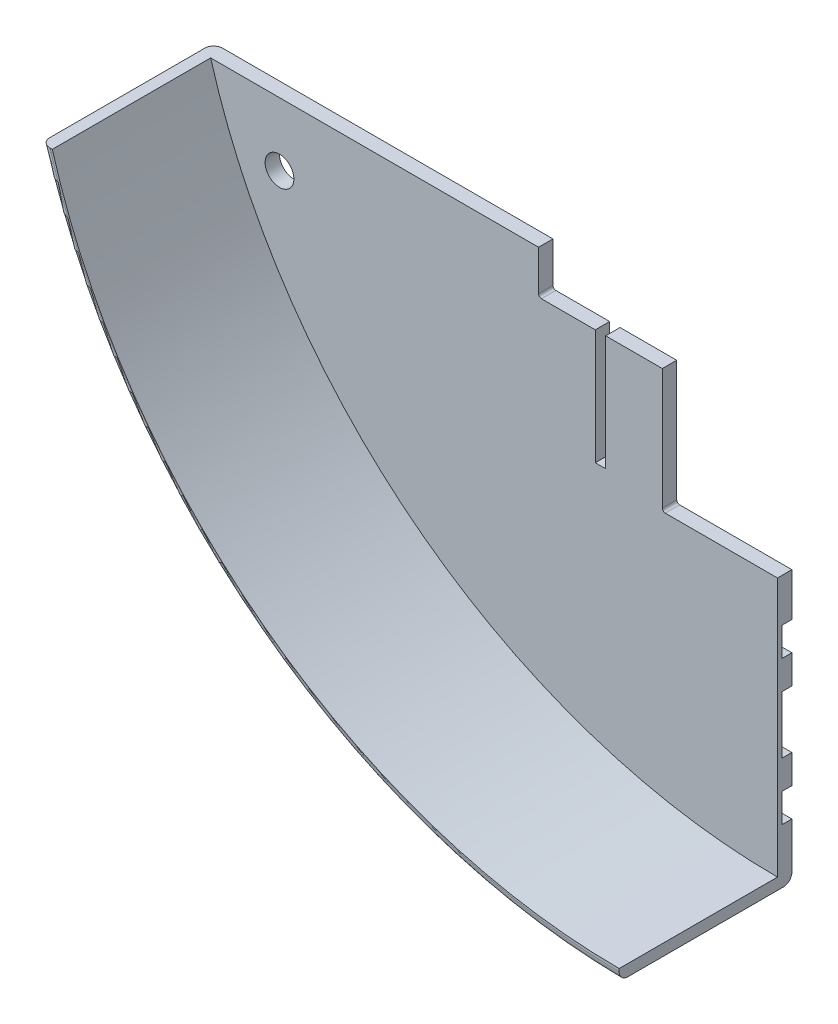
from build123d import *

# Parameters (mm, degrees)
SKETCH1_R           = 5
BOSS_EXTRUDE1_DEPTH = 60
CUT_EXTRUDE1_DEPTH  = 55
CUT_EXTRUDE2_DEPTH  = 3.5
FILLET1_R           = 3
SKETCH4_W           = 18
SKETCH4_H           = 20
CUT_EXTRUDE3_DEPTH  = 3.5
FILLET3_R           = 7
FILLET4_R           = 1
FILLET5_R           = 8
FILLET6_R           = 5


with BuildPart() as part:
    # Sketch1 → Boss-Extrude1 (new body)
    # profile 1 of 2: a face of its own
    with BuildSketch(Plane.XY):
        with BuildLine():
            ThreePointArc((-201.458607688, 71.281187739), (-127.708935748, -35.593764587), (-4.542381846, -76.718812261))
            Line((-4.542381846, -76.718812261), (-4.542381846, -6.718812261))
            Line((-4.542381846, -6.718812261), (-4.542381846, 13.281187739))
            Line((-4.542381846, 13.281187739), (-44.542381846, 13.281187739))
            Line((-44.542381846, 13.281187739), (-44.542381846, 56.281187739))
            Line((-44.542381846, 56.281187739), (-64.242381846, 56.281187739))
            Line((-64.242381846, 56.281187739), (-64.242381846, 16.281187739))
            Line((-64.242381846, 16.281187739), (-67.842381846, 16.281187739))
            Line((-67.842381846, 16.281187739), (-67.842381846, 56.281187739))
            Line((-67.842381846, 56.281187739), (-87.542381846, 56.281187739))
            Line((-87.542381846, 56.281187739), (-87.542381846, 71.281187739))
            Line((-87.542381846, 71.281187739), (-201.458607688, 71.281187739))
        make_face()
        with Locations((-177.542381846, 49.281187739)):
            Circle(SKETCH1_R, mode=Mode.SUBTRACT)
    # profile 2 of 2: a face of its own
    with BuildSketch(Plane.XY):
        with BuildLine():
            Line((-4.542381846, -80.718812261), (-4.542381846, -76.718812261))
            ThreePointArc((-4.542381846, -76.718812261), (-127.708935748, -35.593764587), (-201.458607688, 71.281187739))
            Line((-201.458607688, 71.281187739), (-205.405610163, 71.281187739))
            ThreePointArc((-205.405610163, 71.281187739), (-130.035471154, -37.836764924), (-4.542381846, -80.718812261))
        make_face()
    extrude(amount=BOSS_EXTRUDE1_DEPTH)

    # Sketch2 → Cut-Extrude1 (cut)
    with BuildSketch(Plane.XY.offset(60)):
        with BuildLine():
            Line((-4.542381846, 71.281187739), (-4.542381846, -76.718812261))
            ThreePointArc((-4.542381846, -76.718812261), (-127.708935748, -35.593764587), (-201.458607688, 71.281187739))
            Line((-201.458607688, 71.281187739), (-4.542381846, 71.281187739))
        make_face()
    extrude(amount=-CUT_EXTRUDE1_DEPTH, mode=Mode.SUBTRACT)

    # Sketch3 → Cut-Extrude2 (cut)
    with BuildSketch(Plane(origin=(0, 0, 0), x_dir=(-1, 0, 0), z_dir=(0, 0, -1))):
        Polygon((4.542381846, -61.718812261), (49.542381846, -61.718812261), (49.542381846, -51.718812261), (49.542381846, -21.718812261), (49.542381846, -1.718812261), (4.542381846, -1.718812261), (4.542381846, -11.718812261), (39.542381846, -11.718812261), (39.542381846, -51.718812261), (4.542381846, -51.718812261), align=None)
    extrude(amount=-CUT_EXTRUDE2_DEPTH, mode=Mode.SUBTRACT)

    # Fillet1
    fillet1_edges = [part.edges().sort_by_distance(p)[0] for p in [
        (-130.035471154, -37.836764924, 60),
        (-130.035471154, -37.836764924, 0),
    ]]
    fillet(fillet1_edges, radius=FILLET1_R)

    # Sketch4 → Cut-Extrude3 (cut)
    with BuildSketch(Plane(origin=(0, 0, 0), x_dir=(-1, 0, 0), z_dir=(0, 0, -1))):
        Polygon((102.842381846, -4.039320336), (134.019296382, 13.960679664), (124.019296382, 31.281187739), (92.842381846, 13.281187739), align=None)
        with Locations((13.542381846, -31.718812261)):
            Rectangle(SKETCH4_W, SKETCH4_H)
    extrude(amount=-CUT_EXTRUDE3_DEPTH, mode=Mode.SUBTRACT)

    # Fillet3
    fillet3_edges = [part.edges().sort_by_distance(p)[0] for p in [
        (-102.842381846, -4.039320336, 1.75),
        (-92.842381846, 13.281187739, 1.75),
        (-124.019296382, 31.281187739, 1.75),
        (-134.019296382, 13.960679664, 1.75),
        (-22.542381846, -21.718812261, 1.75),
        (-22.542381846, -41.718812261, 1.75),
    ]]
    fillet(fillet3_edges, radius=FILLET3_R)

    # Fillet4
    fillet4_edges = [part.edges().sort_by_distance(p)[0] for p in [
        (-87.542381846, 56.281187739, 2.5),
        (-44.542381846, 13.281187739, 2.5),
    ]]
    fillet(fillet4_edges, radius=FILLET4_R)

    # Fillet5
    fillet5_edges = [part.edges().sort_by_distance(p)[0] for p in [
        (-49.542381846, -1.718812261, 1.75),
        (-49.542381846, -61.718812261, 1.75),
    ]]
    fillet(fillet5_edges, radius=FILLET5_R)

    # Fillet6
    fillet6_edges = [part.edges().sort_by_distance(p)[0] for p in [
        (-39.542381846, -51.718812261, 1.75),
        (-39.542381846, -11.718812261, 1.75),
    ]]
    fillet(fillet6_edges, radius=FILLET6_R)


solid = part.part
